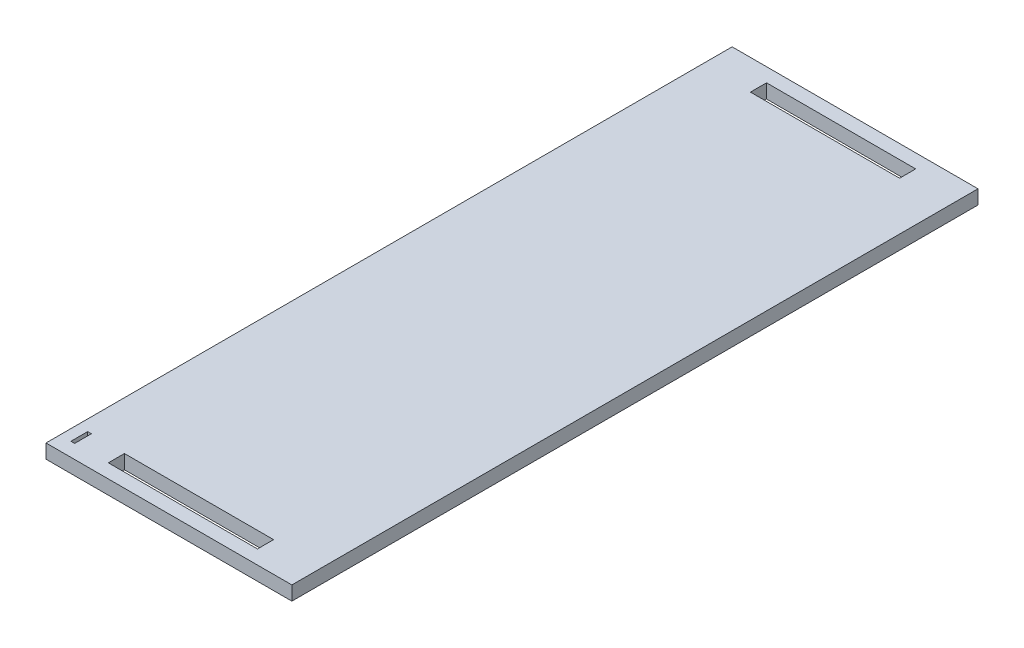
from build123d import *

# Parameters (mm, degrees)
SKETCH1_W           = 52.3380462
SKETCH1_H           = 146.05
SKETCH1_W_2         = 31.75
SKETCH1_H_2         = 3.429
SKETCH1_W_3         = 0.79375
SKETCH1_H_3         = 3.556
BOSS_EXTRUDE1_DEPTH = 2.9972


with BuildPart() as part:
    # Sketch1 → Boss-Extrude1 (new body)
    with BuildSketch(Plane(origin=(0, 0, 0), x_dir=(1, 0, 0), z_dir=(0, 1, 0))):
        Rectangle(SKETCH1_W, SKETCH1_H)
        with Locations((0, 68.3387)):
            Rectangle(SKETCH1_W_2, SKETCH1_H_2, mode=Mode.SUBTRACT)
        with Locations((0, -68.3387)):
            Rectangle(SKETCH1_W_2, SKETCH1_H_2, mode=Mode.SUBTRACT)
        with Locations((-23.432864992, -68.2752)):
            Rectangle(SKETCH1_W_3, SKETCH1_H_3, mode=Mode.SUBTRACT)
    extrude(amount=BOSS_EXTRUDE1_DEPTH)


solid = part.part
